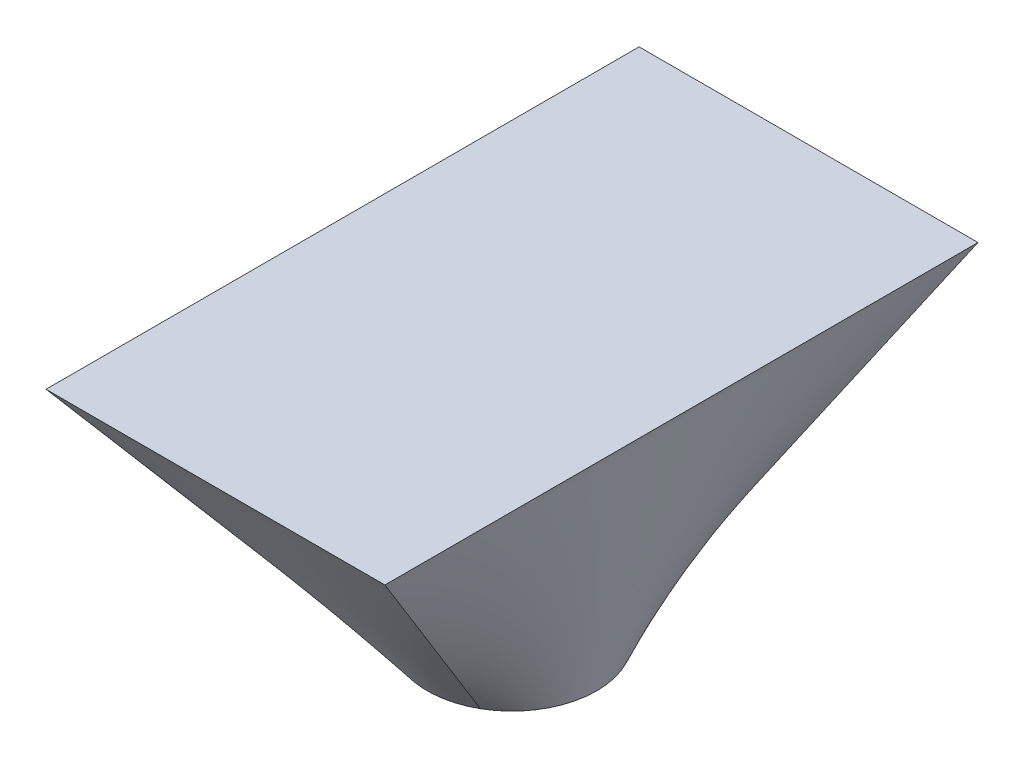
from build123d import *

# Parameters (mm, degrees)
SKETCH3_R          = 1.4
CUT_EXTRUDE1_DEPTH = 8


with BuildPart() as part:
    # Sketch1 for Loft2 → Loft2 section 0
    with BuildSketch(Plane(origin=(0, 0, 0), x_dir=(1, 0, 0), z_dir=(0, 1, 0))):
        with BuildLine():
            # circular arc as an exact rational Bezier (weights 1, cos(half-angle), 1)
            Bezier((-1.488416815, -2.604729426), (0, -3.455253321), (1.488416815, -2.604729426), weights=[1, 0.868243142, 1])
            Bezier((1.488416815, -2.604729426), (6.046693312, 0), (1.488416815, 2.604729426), weights=[1, 0.496138938, 1])
            Bezier((1.488416815, 2.604729426), (0, 3.455253321), (-1.488416815, 2.604729426), weights=[1, 0.868243142, 1])
            Bezier((-1.488416815, 2.604729426), (-6.046693312, 0), (-1.488416815, -2.604729426), weights=[1, 0.496138938, 1])
        make_face()
    # Sketch2 → Loft2 section 1
    with BuildSketch(Plane(origin=(0, 10, 0), x_dir=(1, 0, 0), z_dir=(0, 1, 0))):
        with BuildLine():
            Line((-6, -10.5), (6, -10.5))
            Line((6, -10.5), (6, 10.5))
            Line((6, 10.5), (-6, 10.5))
            Line((-6, 10.5), (-6, -10.5))
        make_face()
    loft()

    # Sketch3 → Cut-Extrude1 (cut)
    with BuildSketch(Plane(origin=(0, 0, 0), x_dir=(1, 0, 0), z_dir=(0, 1, 0))):
        with Locations(Location((0, 0, 0), (0, 0, 270))):
            Circle(SKETCH3_R)
    extrude(amount=CUT_EXTRUDE1_DEPTH, mode=Mode.SUBTRACT)


solid = part.part
